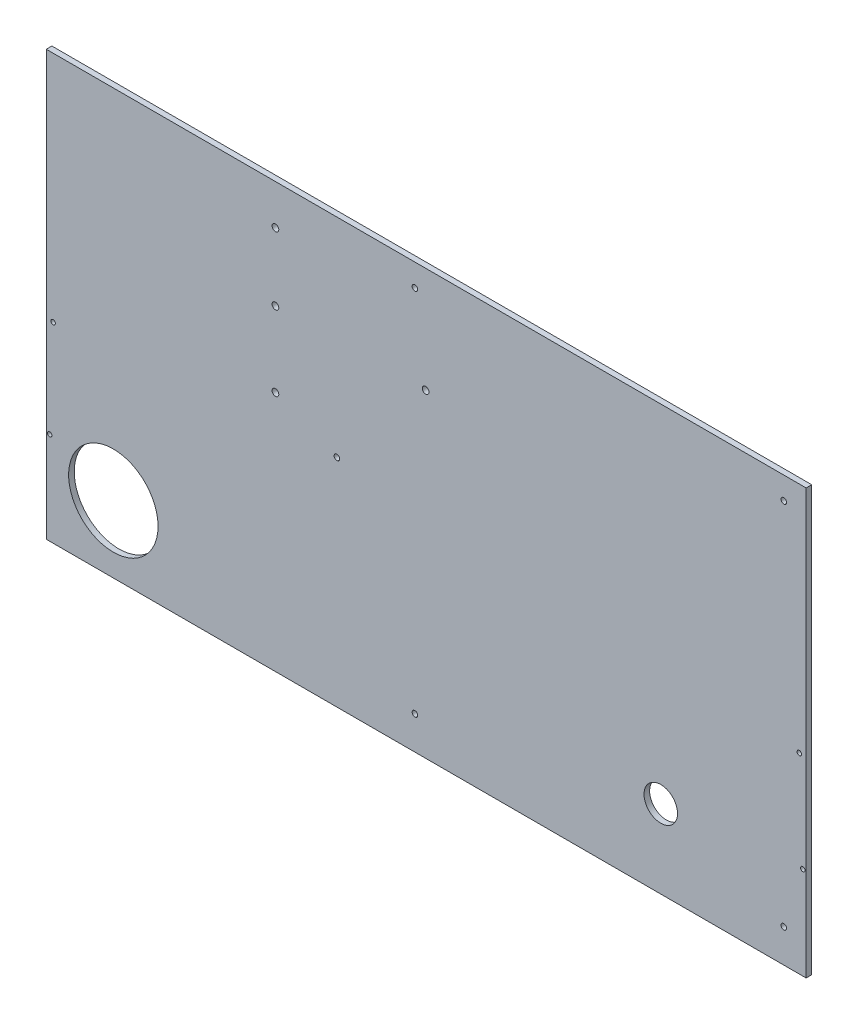
from build123d import *

# Parameters (mm, degrees)
SKETCH1_W           = 863.346
SKETCH1_H           = 482.219
SKETCH1_R           = 2.54
BOSS_EXTRUDE1_DEPTH = 6.35
SKETCH2_R           = 19.05
CUT_EXTRUDE1_DEPTH  = 495.485280286
SKETCH3_R           = 3.81
CUT_EXTRUDE2_DEPTH  = 495.485280286
SKETCH4_R           = 3.175
CUT_EXTRUDE3_DEPTH  = 495.485280286
SKETCH5_R           = 50.8
CUT_EXTRUDE4_DEPTH  = 495.485280286
SKETCH6_R           = 3.175
CUT_EXTRUDE5_DEPTH  = 495.485280286


with BuildPart() as part:
    # Sketch1 → Boss-Extrude1 (new body)
    with BuildSketch(Plane.XY):
        Rectangle(SKETCH1_W, SKETCH1_H)
        with Locations((-423.918892064, -23.561444512)):
            Circle(SKETCH1_R, mode=Mode.SUBTRACT)
        with Locations((-427.847603153, -135.890923479)):
            Circle(SKETCH1_R, mode=Mode.SUBTRACT)
        with Locations(Location((427.847603153, -135.890923479, 0), (0, 0, 180))):
            Circle(SKETCH1_R, mode=Mode.SUBTRACT)
        with Locations(Location((423.918892064, -23.561444512, 0), (0, 0, 180))):
            Circle(SKETCH1_R, mode=Mode.SUBTRACT)
    extrude(amount=BOSS_EXTRUDE1_DEPTH)

    # Sketch2 → Cut-Extrude1 (cut, through all)
    with BuildSketch(Plane.XY.offset(6.35)):
        with Locations((266.52855, -152.344105106)):
            Circle(SKETCH2_R)
    extrude(amount=-CUT_EXTRUDE1_DEPTH, mode=Mode.SUBTRACT)

    # Sketch3 → Cut-Extrude2 (cut, through all)
    with BuildSketch(Plane(origin=(0, 0, 0), x_dir=(-1, 0, 0), z_dir=(0, 0, -1))):
        with Locations((171.299738172, 195.628424293)):
            Circle(SKETCH3_R)
        with Locations((171.299738172, 118.638765896)):
            Circle(SKETCH3_R)
        with Locations((171.299738172, 33.532528438)):
            Circle(SKETCH3_R)
        with Locations((0.611738172, 121.072249047)):
            Circle(SKETCH3_R)
    extrude(amount=-CUT_EXTRUDE2_DEPTH, mode=Mode.SUBTRACT)

    # Sketch4 → Cut-Extrude3 (cut, through all)
    with BuildSketch(Plane.XY.offset(6.35)):
        with Locations((-12.827, 215.7095)):
            Circle(SKETCH4_R)
        with Locations((-12.827, -203.3905)):
            Circle(SKETCH4_R)
        with Locations((406.273, -203.3905)):
            Circle(SKETCH4_R)
        with Locations((406.273, 215.7095)):
            Circle(SKETCH4_R)
    extrude(amount=-CUT_EXTRUDE3_DEPTH, mode=Mode.SUBTRACT)

    # Sketch5 → Cut-Extrude4 (cut, through all)
    with BuildSketch(Plane.XY.offset(6.35)):
        with Locations((-355.473, -164.9095)):
            Circle(SKETCH5_R)
    extrude(amount=-CUT_EXTRUDE4_DEPTH, mode=Mode.SUBTRACT)

    # Sketch6 → Cut-Extrude5 (cut, through all)
    with BuildSketch(Plane.XY.offset(6.35)):
        with Locations((-101.473, 4.6355)):
            Circle(SKETCH6_R)
    extrude(amount=-CUT_EXTRUDE5_DEPTH, mode=Mode.SUBTRACT)


solid = part.part
